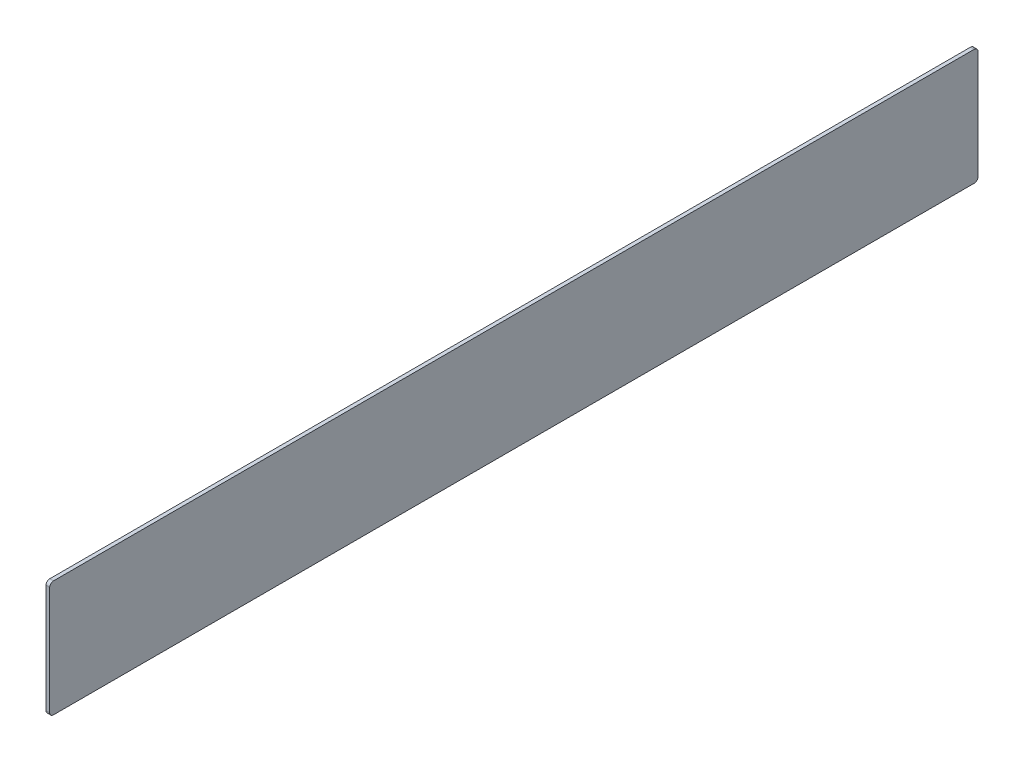
from build123d import *

# Parameters (mm, degrees)
SKETCH1_W           = 500
SKETCH1_H           = 62.5
BOSS_EXTRUDE1_DEPTH = 2
FILLET1_R           = 2


with BuildPart() as part:
    # Sketch1 → Boss-Extrude1 (new body)
    with BuildSketch(Plane(origin=(0, 0, 0), x_dir=(0, 0, -1), z_dir=(1, 0, 0))):
        with Locations((-19.946808511, -109.042553191)):
            Rectangle(SKETCH1_W, SKETCH1_H)
    extrude(amount=BOSS_EXTRUDE1_DEPTH)

    # Fillet1
    fillet1_edges = [part.edges().sort_by_distance(p)[0] for p in [
        (1, -77.792553191, 269.946808511),
        (1, -77.792553191, -230.053191489),
        (1, -140.292553191, -230.053191489),
        (1, -140.292553191, 269.946808511),
    ]]
    fillet(fillet1_edges, radius=FILLET1_R)


solid = part.part
